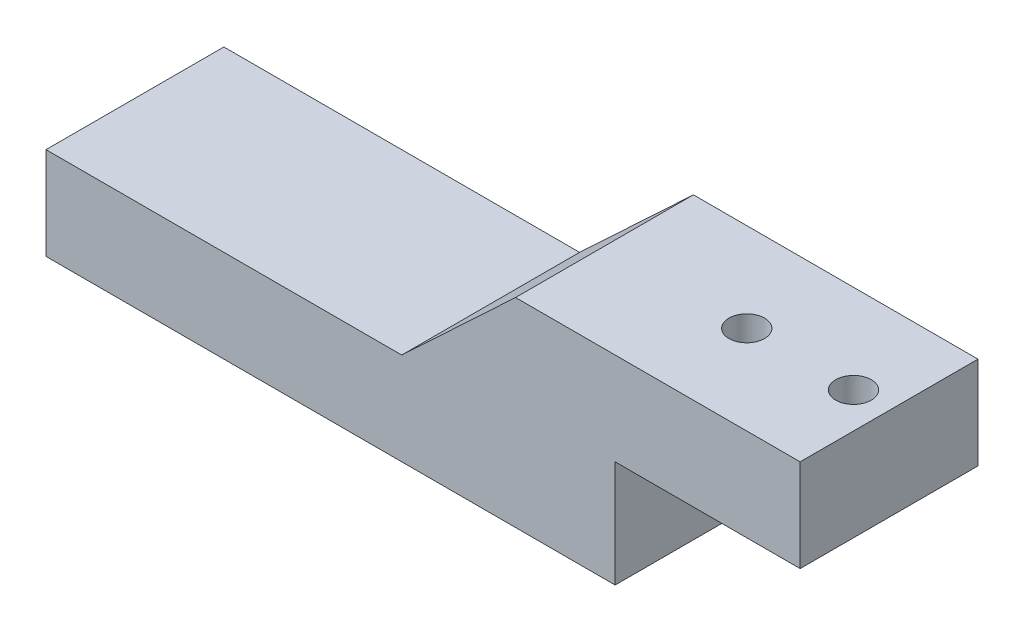
from build123d import *

# Parameters (mm, degrees)
BOSS_EXTRUDE1_DEPTH = 25
SKETCH2_R           = 2.5
CUT_EXTRUDE1_DEPTH  = 90.489411687


with BuildPart() as part:
    # Sketch1 → Boss-Extrude1 (new body)
    with BuildSketch(Plane.XY):
        Polygon((0, 0), (55.236413043, 0), (55.236413043, 15), (81.236413043, 15), (81.236413043, 28), (41.236413043, 28), (25.236413043, 13), (-24.763586957, 13), (-24.763586957, 0), align=None)
    extrude(amount=BOSS_EXTRUDE1_DEPTH)

    # Sketch2 → Cut-Extrude1 (cut, through all)
    with BuildSketch(Plane(origin=(0, 28, 0), x_dir=(1, 0, 0), z_dir=(0, 1, 0))):
        with Locations(Location((76.236413043, -12.5, 0), (0, 0, 180))):
            Circle(SKETCH2_R)
        with Locations(Location((61.236413043, -12.5, 0), (0, 0, 180))):
            Circle(SKETCH2_R)
    extrude(amount=-CUT_EXTRUDE1_DEPTH, mode=Mode.SUBTRACT)


solid = part.part
